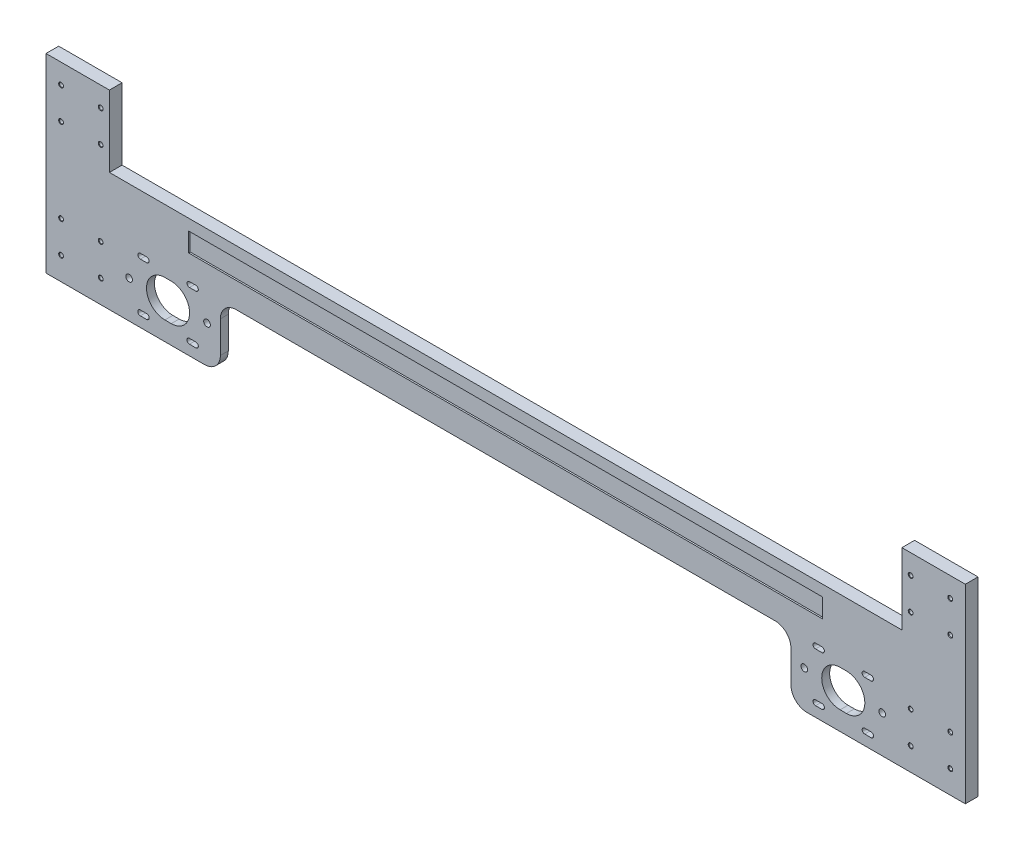
from build123d import *

# Parameters (mm, degrees)
BOSS_EXTRUDE1_DEPTH         = 8
SKETCH5_W                   = 120
SKETCH5_H                   = 40
BOSS_EXTRUDE4_DEPTH         = 8
M3_TAPPED_HOLE2_D           = 2.5
M3_TAPPED_HOLE2_CSINK_D     = 3.05
M3_TAPPED_HOLE2_CSINK_ANGLE = 90
SKETCH24_W                  = 400
SKETCH24_H                  = 12
CUT_EXTRUDE4_DEPTH          = 1
M5_TAPPED_HOLE3_D           = 4.2
M5_TAPPED_HOLE3_CSINK_D     = 5.05
M5_TAPPED_HOLE3_CSINK_ANGLE = 90
MIRROR3_COPY_1_D            = 2.5
MIRROR3_COPY_1_CSINK_D      = 3.05
MIRROR3_COPY_1_CSINK_ANGLE  = 90
MIRROR3_COPY_2_D            = 2.5
MIRROR3_COPY_2_CSINK_D      = 3.05
MIRROR3_COPY_2_CSINK_ANGLE  = 90
SKETCH27_W                  = 54.08
SKETCH27_H                  = 3
CUT_EXTRUDE6_DEPTH          = 50


with BuildPart() as part:
    # Sketch1 → Boss-Extrude1 (new body)
    with BuildSketch(Plane.XY):
        with BuildLine():
            Line((-250, -33.879809267), (-240, -33.879809267))
            Line((-240, -33.879809267), (-200, -33.879809267))
            Line((-200, -33.879809267), (-190, -33.879809267))
            ThreePointArc((-190, -33.879809267), (-182.928932188, -30.950877079), (-180, -23.879809267))
            Line((-180, -23.879809267), (-180, -3.879809267))
            ThreePointArc((-180, -3.879809267), (-177.071067812, 3.191258545), (-170, 6.120190733))
            Line((-170, 6.120190733), (-150, 6.120190733))
            Line((-150, 6.120190733), (150, 6.120190733))
            Line((150, 6.120190733), (170, 6.120190733))
            ThreePointArc((170, 6.120190733), (177.071067812, 3.191258545), (180, -3.879809267))
            Line((180, -3.879809267), (180, -23.879809267))
            ThreePointArc((180, -23.879809267), (182.928932188, -30.950877079), (190, -33.879809267))
            Line((190, -33.879809267), (200, -33.879809267))
            Line((200, -33.879809267), (240, -33.879809267))
            Line((240, -33.879809267), (250, -33.879809267))
            Line((250, -33.879809267), (250, 36.120190733))
            Line((250, 36.120190733), (250, 41.120190733))
            Line((250, 41.120190733), (-250, 41.120190733))
            Line((-250, 41.120190733), (-250, 36.120190733))
            Line((-250, 36.120190733), (-250, -23.879809267))
            Line((-250, -23.879809267), (-250, -33.879809267))
        make_face()
        with BuildLine():
            ThreePointArc((-230.5, -27.479809267), (-232.1, -25.879809267), (-230.5, -24.279809267))
            Line((-230.5, -24.279809267), (-226.5, -24.279809267))
            ThreePointArc((-226.5, -24.279809267), (-224.9, -25.879809267), (-226.5, -27.479809267))
            Line((-226.5, -27.479809267), (-230.5, -27.479809267))
        make_face(mode=Mode.SUBTRACT)
        with BuildLine():
            ThreePointArc((-195.5, -24.279809267), (-193.9, -25.879809267), (-195.5, -27.479809267))
            Line((-195.5, -27.479809267), (-199.5, -27.479809267))
            ThreePointArc((-199.5, -27.479809267), (-201.1, -25.879809267), (-199.5, -24.279809267))
            Line((-199.5, -24.279809267), (-195.5, -24.279809267))
        make_face(mode=Mode.SUBTRACT)
        with BuildLine():
            Line((-215, 1.220190733), (-211, 1.220190733))
            ThreePointArc((-211, 1.220190733), (-199.4, -10.379809267), (-211, -21.979809267))
            Line((-211, -21.979809267), (-215, -21.979809267))
            ThreePointArc((-215, -21.979809267), (-226.6, -10.379809267), (-215, 1.220190733))
        make_face(mode=Mode.SUBTRACT)
        with BuildLine():
            ThreePointArc((195.5, -27.479809267), (193.9, -25.879809267), (195.5, -24.279809267))
            Line((195.5, -24.279809267), (199.5, -24.279809267))
            ThreePointArc((199.5, -24.279809267), (201.1, -25.879809267), (199.5, -27.479809267))
            Line((199.5, -27.479809267), (195.5, -27.479809267))
        make_face(mode=Mode.SUBTRACT)
        with BuildLine():
            ThreePointArc((230.5, -24.279809267), (232.1, -25.879809267), (230.5, -27.479809267))
            Line((230.5, -27.479809267), (226.5, -27.479809267))
            ThreePointArc((226.5, -27.479809267), (224.9, -25.879809267), (226.5, -24.279809267))
            Line((226.5, -24.279809267), (230.5, -24.279809267))
        make_face(mode=Mode.SUBTRACT)
        with BuildLine():
            Line((215, -21.979809267), (211, -21.979809267))
            ThreePointArc((211, -21.979809267), (199.4, -10.379809267), (211, 1.220190733))
            Line((211, 1.220190733), (215, 1.220190733))
            ThreePointArc((215, 1.220190733), (226.6, -10.379809267), (215, -21.979809267))
        make_face(mode=Mode.SUBTRACT)
        with BuildLine():
            Line((-226.5, 3.520190733), (-230.5, 3.520190733))
            ThreePointArc((-230.5, 3.520190733), (-232.1, 5.120190733), (-230.5, 6.720190733))
            Line((-230.5, 6.720190733), (-226.5, 6.720190733))
            ThreePointArc((-226.5, 6.720190733), (-224.9, 5.120190733), (-226.5, 3.520190733))
        make_face(mode=Mode.SUBTRACT)
        with BuildLine():
            Line((-199.5, 6.720190733), (-195.5, 6.720190733))
            ThreePointArc((-195.5, 6.720190733), (-193.9, 5.120190733), (-195.5, 3.520190733))
            Line((-195.5, 3.520190733), (-199.5, 3.520190733))
            ThreePointArc((-199.5, 3.520190733), (-201.1, 5.120190733), (-199.5, 6.720190733))
        make_face(mode=Mode.SUBTRACT)
        with BuildLine():
            Line((199.5, 3.520190733), (195.5, 3.520190733))
            ThreePointArc((195.5, 3.520190733), (193.9, 5.120190733), (195.5, 6.720190733))
            Line((195.5, 6.720190733), (199.5, 6.720190733))
            ThreePointArc((199.5, 6.720190733), (201.1, 5.120190733), (199.5, 3.520190733))
        make_face(mode=Mode.SUBTRACT)
        with BuildLine():
            Line((226.5, 6.720190733), (230.5, 6.720190733))
            ThreePointArc((230.5, 6.720190733), (232.1, 5.120190733), (230.5, 3.520190733))
            Line((230.5, 3.520190733), (226.5, 3.520190733))
            ThreePointArc((226.5, 3.520190733), (224.9, 5.120190733), (226.5, 6.720190733))
        make_face(mode=Mode.SUBTRACT)
    extrude(amount=BOSS_EXTRUDE1_DEPTH)

    # Sketch5 → Boss-Extrude4 (add)
    with BuildSketch(Plane(origin=(-195.879809267, 36.120190733, 8), x_dir=(0, -1, 0), z_dir=(0, 0, -1))):
        with Locations((10, 74.120190733)):
            Rectangle(SKETCH5_W, SKETCH5_H)
    boss_extrude4 = extrude(amount=BOSS_EXTRUDE4_DEPTH)

    # M3 Tapped Hole2 (through all)
    with Locations(Plane(origin=(-280.5, 53.620190733, 8), x_dir=(1, 0, 0), z_dir=(0, 0, 1))):
        with Locations((0, 0), (25, 20), (25, 0), (0, 20)):
            m3_tapped_hole2 = CounterSinkHole(M3_TAPPED_HOLE2_D / 2, M3_TAPPED_HOLE2_CSINK_D / 2, counter_sink_angle=M3_TAPPED_HOLE2_CSINK_ANGLE)

    # Mirror1: Boss-Extrude4, M3 Tapped Hole2 across plane
    add(boss_extrude4.mirror(Plane(origin=(0, 0, 0), x_dir=(0, 0, 1), z_dir=(1, 0, 0))))
    add(m3_tapped_hole2.mirror(Plane(origin=(0, 0, 0), x_dir=(0, 0, 1), z_dir=(1, 0, 0))), mode=Mode.SUBTRACT)

    # Sketch24 → Cut-Extrude4 (cut)
    with BuildSketch(Plane.XY.offset(8)):
        with Locations((0, 28.120190733)):
            Rectangle(SKETCH24_W, SKETCH24_H)
    extrude(amount=-CUT_EXTRUDE4_DEPTH, mode=Mode.SUBTRACT)

    # M5 Tapped Hole3 (through all)
    with Locations(Plane(origin=(0, 0, 0), x_dir=(-1, 0, 0), z_dir=(0, 0, -1))):
        with Locations((237.58, -10.379809267), (188.42, -10.379809267), (-188.42, -10.379809267), (-237.58, -10.379809267)):
            CounterSinkHole(M5_TAPPED_HOLE3_D / 2, M5_TAPPED_HOLE3_CSINK_D / 2, counter_sink_angle=M5_TAPPED_HOLE3_CSINK_ANGLE)

    # Mirror2: M3 Tapped Hole2 across plane
    add(m3_tapped_hole2.mirror(Plane(origin=(0, 27.120190733, 0), x_dir=(0, 0, 1), z_dir=(0, -1, 0))), mode=Mode.SUBTRACT)

    # Mirror3 copy 1 (through all)
    with Locations(Plane(origin=(280.5, 0.620190733, 8), x_dir=(-1, 0, 0), z_dir=(0, 0, 1))):
        with Locations((0, 0), (25, 20), (25, 0), (0, 20)):
            CounterSinkHole(MIRROR3_COPY_1_D / 2, MIRROR3_COPY_1_CSINK_D / 2, counter_sink_angle=MIRROR3_COPY_1_CSINK_ANGLE)

    # Mirror3 copy 2 (through all)
    with Locations(Plane(origin=(280.5, 53.620190733, 8), x_dir=(-1, 0, 0), z_dir=(0, 0, 1))):
        with Locations((0, 0), (25, -20), (25, 0), (0, -20)):
            CounterSinkHole(MIRROR3_COPY_2_D / 2, MIRROR3_COPY_2_CSINK_D / 2, counter_sink_angle=MIRROR3_COPY_2_CSINK_ANGLE)

    # Sketch27 → Cut-Extrude6 (cut)
    with BuildSketch(Plane.XZ.offset(33.879809267)):
        with Locations((217.04, 1.5)):
            Rectangle(SKETCH27_W, SKETCH27_H)
        Polygon((166, -7.690904526), (244.08, -7.690904526), (244.08, 0), (190, 0), (190, 3), (166, 3), align=None)
    cut_extrude6 = extrude(amount=-CUT_EXTRUDE6_DEPTH, mode=Mode.SUBTRACT)

    # Mirror4: Cut-Extrude6 across plane
    add(cut_extrude6.mirror(Plane(origin=(0, 0, 0), x_dir=(0, 0, 1), z_dir=(1, 0, 0))), mode=Mode.SUBTRACT)


solid = part.part
